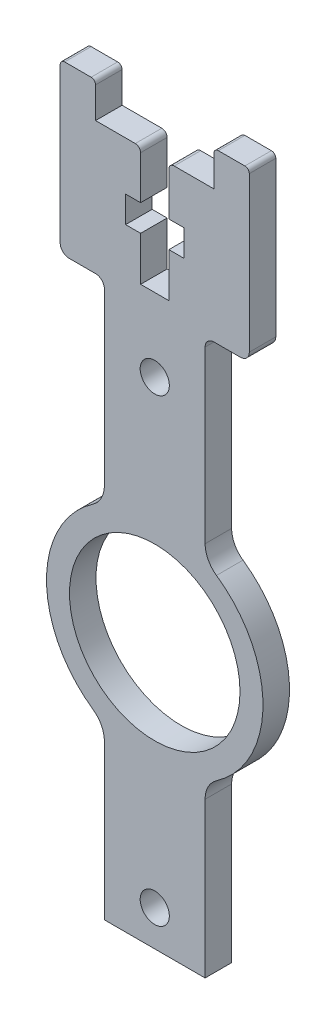
from build123d import *

# Parameters (mm, degrees)
SKETCH_1_R      = 9.65
SKETCH_1_R_2    = 1.65
EXTRUDE_1_DEPTH = 3
FILLET_2_R      = 1
FILLET_3_R      = 0.6
FILLET_4_R      = 0.5
FILLET_5_R      = 3


with BuildPart() as part:
    # 草图1 → 凸台-拉伸1 (new body)
    with BuildSketch(Plane.XY):
        with BuildLine():
            Line((0, 0), (4, 0))
            Line((4, 0), (4, -4))
            Line((4, -4), (9.1, -4))
            Line((9.1, -4), (9.1, -9.5))
            Line((9.1, -9.5), (7.4, -9.5))
            Line((7.4, -9.5), (7.4, -12.5))
            Line((7.4, -12.5), (9.1, -12.5))
            Line((9.1, -12.5), (9.1, -17.5))
            Line((9.1, -17.5), (12.3, -17.5))
            Line((12.3, -17.5), (12.3, -12.5))
            Line((12.3, -12.5), (14, -12.5))
            Line((14, -12.5), (14, -9.5))
            Line((14, -9.5), (12.3, -9.5))
            Line((12.3, -9.5), (12.3, -4))
            Line((12.3, -4), (17.4, -4))
            Line((17.4, -4), (17.4, 0))
            Line((17.4, 0), (21.4, 0))
            Line((21.4, 0), (21.4, -4))
            Line((21.4, -4), (21.4, -19))
            Line((21.4, -19), (16.4, -19))
            Line((16.4, -19), (16.4, -40.956914646))
            ThreePointArc((16.4, -40.956914646), (22.95, -51.8), (16.4, -62.643085354))
            Line((16.4, -62.643085354), (16.4, -81.843085354))
            Line((16.4, -81.843085354), (5, -81.843085354))
            Line((5, -81.843085354), (5, -62.643085354))
            ThreePointArc((5, -62.643085354), (-1.55, -51.8), (5, -40.956914646))
            Line((5, -40.956914646), (5, -19))
            Line((5, -19), (0, -19))
            Line((0, -19), (0, -4))
            Line((0, -4), (0, 0))
        make_face()
        with Locations((10.7, -51.8)):
            Circle(SKETCH_1_R, mode=Mode.SUBTRACT)
        with Locations((10.7, -25.8)):
            Circle(SKETCH_1_R_2, mode=Mode.SUBTRACT)
        with Locations((10.7, -77.8)):
            Circle(SKETCH_1_R_2, mode=Mode.SUBTRACT)
    extrude(amount=EXTRUDE_1_DEPTH)

    # 圆角2
    fillet_2_edges = [part.edges().sort_by_distance(p)[0] for p in [
        (21.4, -19, 1.5),
        (16.4, -19, 1.5),
        (5, -19, 1.5),
        (0, -19, 1.5),
    ]]
    fillet(fillet_2_edges, radius=FILLET_2_R)

    # 圆角3
    fillet_3_edges = [part.edges().sort_by_distance(p)[0] for p in [
        (9.1, -4, 1.5),
        (12.3, -4, 1.5),
    ]]
    fillet(fillet_3_edges, radius=FILLET_3_R)

    # 圆角4
    fillet_4_edges = [part.edges().sort_by_distance(p)[0] for p in [
        (0, 0, 1.5),
        (4, 0, 1.5),
        (17.4, 0, 1.5),
        (21.4, 0, 1.5),
    ]]
    fillet(fillet_4_edges, radius=FILLET_4_R)

    # 圆角5
    fillet_5_edges = [part.edges().sort_by_distance(p)[0] for p in [
        (16.4, -40.956914646, 1.5),
        (16.4, -62.643085354, 1.5),
        (5, -62.643085354, 1.5),
        (5, -40.956914646, 1.5),
    ]]
    fillet(fillet_5_edges, radius=FILLET_5_R)


solid = part.part
